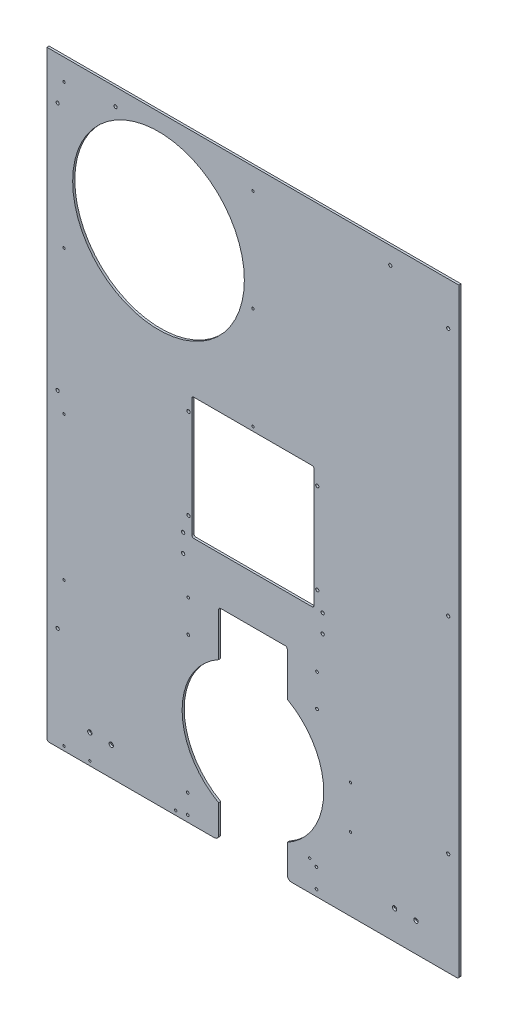
from build123d import *

# Parameters (mm, degrees)
SKETCH1_W                                     = 1219.2
SKETCH1_H                                     = 1778
SKETCH1_R                                     = 254
SKETCH1_W_2                                   = 361.95
SKETCH1_H_2                                   = 361.95
BOSS_EXTRUDE1_DEPTH                           = 6.35
SKETCH3_R                                     = 209.55
CUT_EXTRUDE2_DEPTH                            = 2156.869421486
SKETCH2_W                                     = 203.2
SKETCH2_H                                     = 165.1
CUT_EXTRUDE1_DEPTH                            = 2156.869421486
SKETCH4_R                                     = 3.3655
CUT_EXTRUDE3_DEPTH                            = 2156.869421486
LPATTERN1_COUNT                               = 5
LPATTERN1_PITCH                               = 425.45
SKETCH5_R                                     = 3.429
CUT_EXTRUDE4_DEPTH                            = 2156.869421486
LPATTERN2_COUNT                               = 3
LPATTERN2_PITCH                               = 301.625
SKETCH6_R                                     = 3.3782
CUT_EXTRUDE5_DEPTH                            = 2156.869421486
SKETCH7_R                                     = 3.3782
CUT_EXTRUDE6_DEPTH                            = 2156.869421486
CSK_FOR_1_4_FLAT_HEAD_MACHINE_SCREW1_AT_COUNT = 2
CSK_FOR_1_4_FLAT_HEAD_MACHINE_SCREW1_AT_PITCH = 63.5
LPATTERN3_COUNT                               = 2
LPATTERN3_PITCH                               = 901.7
SKETCH12_R                                    = 4.7625
CUT_EXTRUDE7_DEPTH                            = 2156.869421486
SKETCH14_R                                    = 4.7625
CUT_EXTRUDE8_DEPTH                            = 2156.869421486
SKETCH15_R                                    = 4.7625
CUT_EXTRUDE9_DEPTH                            = 2156.869421486
SKETCH16_R                                    = 4.7625
CUT_EXTRUDE10_DEPTH                           = 2156.869421486
FILLET1_R                                     = 12.7
FILLET2_R                                     = 6.35
SKETCH17_R                                    = 3.937
CUT_EXTRUDE11_DEPTH                           = 2156.869421486
SKETCH18_R                                    = 3.96875
CUT_EXTRUDE12_DEPTH                           = 2156.869421486


with BuildPart() as part:
    # Sketch1 → Boss-Extrude1 (new body)
    with BuildSketch(Plane.XY):
        with Locations((609.6, 889)):
            Rectangle(SKETCH1_W, SKETCH1_H)
        with Locations((330.2, 1473.2)):
            Circle(SKETCH1_R, mode=Mode.SUBTRACT)
        with Locations((609.6, 917.575)):
            Rectangle(SKETCH1_W_2, SKETCH1_H_2, mode=Mode.SUBTRACT)
    extrude(amount=BOSS_EXTRUDE1_DEPTH)

    # Sketch3 → Cut-Extrude2 (cut, through all)
    with BuildSketch(Plane.XY.offset(6.35)):
        with Locations((609.6, 279.4)):
            Circle(SKETCH3_R)
    extrude(amount=-CUT_EXTRUDE2_DEPTH, mode=Mode.SUBTRACT)

    # Sketch2 → Cut-Extrude1 (cut, through all)
    with BuildSketch(Plane.XY.offset(6.35)):
        with Locations((609.6, 44.45)):
            Rectangle(SKETCH2_W, SKETCH2_H)
        with Locations((609.6, 514.35)):
            Rectangle(SKETCH2_W, SKETCH2_H)
    extrude(amount=-CUT_EXTRUDE1_DEPTH, mode=Mode.SUBTRACT)

    # Sketch4 → Cut-Extrude3 (cut, through all)
    with BuildSketch(Plane.XY.offset(6.35)):
        with Locations((50.8, 12.7)):
            Circle(SKETCH4_R)
    cut_extrude3 = extrude(amount=-CUT_EXTRUDE3_DEPTH, mode=Mode.SUBTRACT)

    # LPattern1: Cut-Extrude3 ×5
    with Locations(*[(0, i * LPATTERN1_PITCH, 0) for i in range(1, LPATTERN1_COUNT)]):
        add(cut_extrude3, mode=Mode.SUBTRACT)

    # Sketch5 → Cut-Extrude4 (cut, through all)
    with BuildSketch(Plane.XY.offset(6.35)):
        with Locations((609.6, 1714.5)):
            Circle(SKETCH5_R)
    cut_extrude4 = extrude(amount=-CUT_EXTRUDE4_DEPTH, mode=Mode.SUBTRACT)

    # LPattern2: Cut-Extrude4 ×3
    with Locations(*[(0, -i * LPATTERN2_PITCH, 0) for i in range(1, LPATTERN2_COUNT)]):
        add(cut_extrude4, mode=Mode.SUBTRACT)

    # Sketch6 → Cut-Extrude5 (cut, through all)
    with BuildSketch(Plane.XY.offset(6.35)):
        with Locations((127, 12.7)):
            Circle(SKETCH6_R)
        with Locations((381, 12.7)):
            Circle(SKETCH6_R)
    extrude(amount=-CUT_EXTRUDE5_DEPTH, mode=Mode.SUBTRACT)

    # Sketch7 → Cut-Extrude6 (cut, through all)
    with BuildSketch(Plane.XY.offset(6.35)):
        with Locations((777.605208253, 88.9)):
            Circle(SKETCH7_R)
        with Locations((898.525, 342.9)):
            Circle(SKETCH7_R)
        with Locations((898.525, 215.9)):
            Circle(SKETCH7_R)
    extrude(amount=-CUT_EXTRUDE6_DEPTH, mode=Mode.SUBTRACT)

    # Sketch11 → CSK for 1/4 Flat Head Machine Screw1 (revolve, cut)
    with BuildSketch(Plane(origin=(127, 85.725, 6.35), x_dir=(0, -1, 0), z_dir=(1, 0, 0))):
        Polygon((0, 0), (0, 6.35), (3.57124, 6.35), (3.57124, 3.298865467), (6.4389, 0), align=None)
    csk_for_1_4_flat_head_machine_screw1 = revolve(axis=Axis((127, 85.725, 12.7), (0, 0, -1)), mode=Mode.SUBTRACT)

    # CSK for 1/4 Flat Head Machine Screw1 at: CSK for 1/4 Flat Head Machine Screw1 ×2
    with Locations(*[(i * CSK_FOR_1_4_FLAT_HEAD_MACHINE_SCREW1_AT_PITCH, 0, 0) for i in range(1, CSK_FOR_1_4_FLAT_HEAD_MACHINE_SCREW1_AT_COUNT)]):
        add(csk_for_1_4_flat_head_machine_screw1, mode=Mode.SUBTRACT)

    # LPattern3: CSK for 1/4 Flat Head Machine Screw1 ×2
    with Locations(*[(i * LPATTERN3_PITCH, 0, 0) for i in range(1, LPATTERN3_COUNT)]):
        add(csk_for_1_4_flat_head_machine_screw1, mode=Mode.SUBTRACT)

    # LPattern3 copy 1 sketch → LPattern3 copy 1 (revolve, cut)
    with BuildSketch(Plane(origin=(1092.2, 85.725, 6.35), x_dir=(0, -1, 0), z_dir=(1, 0, 0))):
        Polygon((0, 0), (0, 6.35), (3.57124, 6.35), (3.57124, 3.298865467), (6.4389, 0), align=None)
    revolve(axis=Axis((1092.2, 85.725, 12.7), (0, 0, -1)), mode=Mode.SUBTRACT)

    # Sketch12 → Cut-Extrude7 (cut, through all)
    with BuildSketch(Plane.XY.offset(6.35)):
        with Locations((203.2, 1727.2)):
            Circle(SKETCH12_R)
        with Locations((1016, 1727.2)):
            Circle(SKETCH12_R)
    extrude(amount=-CUT_EXTRUDE7_DEPTH, mode=Mode.SUBTRACT)

    # Sketch14 → Cut-Extrude8 (cut, through all)
    with BuildSketch(Plane.XY.offset(6.35)):
        with Locations((31.75, 1651)):
            Circle(SKETCH14_R)
        with Locations((31.75, 914.4)):
            Circle(SKETCH14_R)
        with Locations((31.75, 304.8)):
            Circle(SKETCH14_R)
    cut_extrude8 = extrude(amount=-CUT_EXTRUDE8_DEPTH, mode=Mode.SUBTRACT)

    # Mirror1: Cut-Extrude8 across plane
    add(cut_extrude8.mirror(Plane.ZY.offset(-609.6)), mode=Mode.SUBTRACT)

    # Sketch15 → Cut-Extrude9 (cut, through all)
    with BuildSketch(Plane.XY.offset(6.35)):
        with Locations((403.225, 736.6)):
            Circle(SKETCH15_R)
        with Locations((403.225, 682.625)):
            Circle(SKETCH15_R)
    cut_extrude9 = extrude(amount=-CUT_EXTRUDE9_DEPTH, mode=Mode.SUBTRACT)

    # Mirror2: Cut-Extrude9 across plane
    add(cut_extrude9.mirror(Plane.ZY.offset(-609.6)), mode=Mode.SUBTRACT)

    # Sketch16 → Cut-Extrude10 (cut, through all)
    with BuildSketch(Plane.XY.offset(6.35)):
        with Locations((419.1, 1054.1)):
            Circle(SKETCH16_R)
        with Locations((419.1, 787.4)):
            Circle(SKETCH16_R)
        with Locations((800.1, 1054.1)):
            Circle(SKETCH16_R)
        with Locations((800.1, 787.4)):
            Circle(SKETCH16_R)
    extrude(amount=-CUT_EXTRUDE10_DEPTH, mode=Mode.SUBTRACT)

    # Fillet1
    fillet1_edges = [part.edges().sort_by_distance(p)[0] for p in [
        (508, 0, 3.175),
        (711.2, 0, 3.175),
    ]]
    fillet(fillet1_edges, radius=FILLET1_R)

    # Fillet2
    fillet2_edges = [part.edges().sort_by_distance(p)[0] for p in [
        (428.625, 1098.55, 3.175),
        (428.625, 736.6, 3.175),
        (790.575, 736.6, 3.175),
        (790.575, 1098.55, 3.175),
        (711.2, 596.9, 3.175),
        (508, 596.9, 3.175),
        (0, 0, 3.175),
        (1219.2, 0, 3.175),
    ]]
    fillet(fillet2_edges, radius=FILLET2_R)

    # Sketch17 → Cut-Extrude11 (cut, through all)
    with BuildSketch(Plane.XY.offset(6.35)):
        with Locations((416.56762, 76.2)):
            Circle(SKETCH17_R)
        with Locations((416.56762, 19.05)):
            Circle(SKETCH17_R)
        with Locations((797.56762, 19.05)):
            Circle(SKETCH17_R)
        with Locations((797.56762, 76.2)):
            Circle(SKETCH17_R)
    extrude(amount=-CUT_EXTRUDE11_DEPTH, mode=Mode.SUBTRACT)

    # Sketch18 → Cut-Extrude12 (cut, through all)
    with BuildSketch(Plane.XY.offset(6.35)):
        with Locations((418.15512, 576.972045059)):
            Circle(SKETCH18_R)
        with Locations((418.15512, 481.722045059)):
            Circle(SKETCH18_R)
        with Locations((799.15512, 481.722045059)):
            Circle(SKETCH18_R)
        with Locations((799.15512, 576.972045059)):
            Circle(SKETCH18_R)
    extrude(amount=-CUT_EXTRUDE12_DEPTH, mode=Mode.SUBTRACT)


solid = part.part
